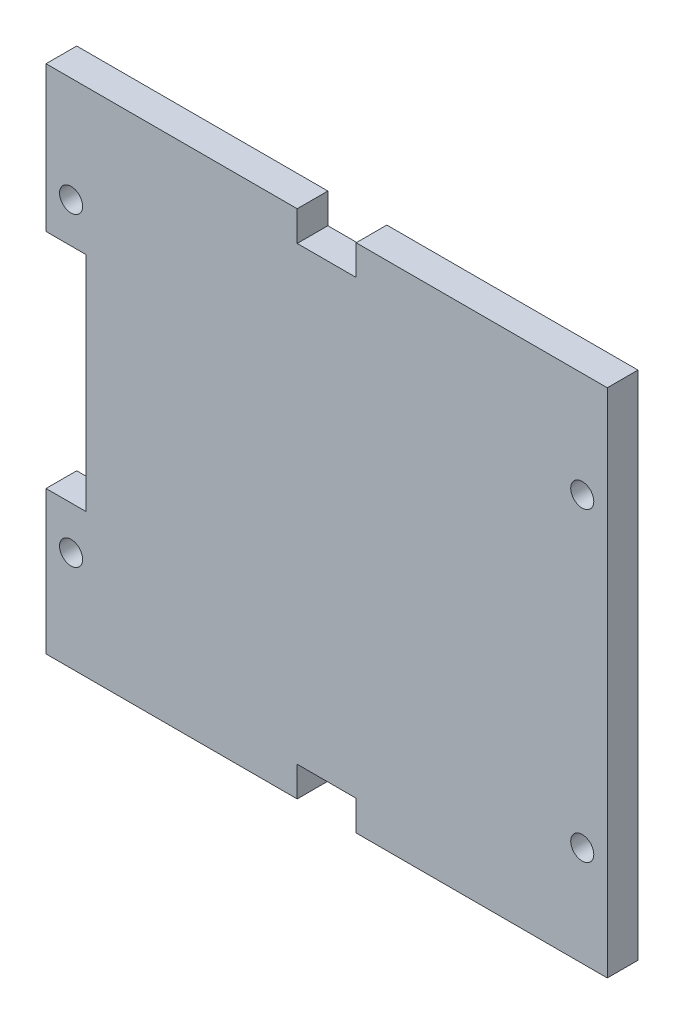
from build123d import *

# Parameters (mm, degrees)
BOSS_EXTRUDE1_DEPTH = 3.06
SKETCH2_R           = 1.15
SKETCH2_W           = 4
SKETCH2_H           = 22.201866978
CUT_EXTRUDE1_DEPTH  = 74.819804931


with BuildPart() as part:
    # Sketch1 → Boss-Extrude1 (new body)
    with BuildSketch(Plane.XY):
        Polygon((25.06, 0), (30.94, 0), (30.94, -3), (56, -3), (56, 0), (56, 45), (56, 48), (30.94, 48), (30.94, 45), (25.06, 45), (25.06, 48), (0, 48), (0, 45), (0, 0), (0, -3), (25.06, -3), align=None)
    extrude(amount=BOSS_EXTRUDE1_DEPTH)

    # Sketch2 → Cut-Extrude1 (cut, through all)
    with BuildSketch(Plane.XY.offset(3.06)):
        with Locations((2.5, 37.5)):
            Circle(SKETCH2_R)
        with Locations((53.5, 37.5)):
            Circle(SKETCH2_R)
        with Locations((53.5, 7)):
            Circle(SKETCH2_R)
        with Locations((2.5, 7)):
            Circle(SKETCH2_R)
        with Locations((2, 22.399066511)):
            Rectangle(SKETCH2_W, SKETCH2_H)
    extrude(amount=-CUT_EXTRUDE1_DEPTH, mode=Mode.SUBTRACT)


solid = part.part
